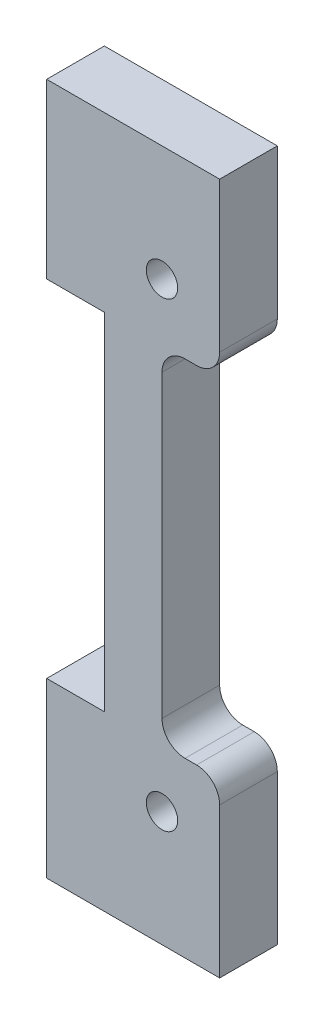
from build123d import *

# Parameters (mm, degrees)
BOSS_EXTRUDE1_START = -6.35
BOSS_EXTRUDE1_DEPTH = 6.35
FILLET1_R           = 2.54
SKETCH2_R           = 1.7272
CUT_EXTRUDE1_DEPTH  = 129.734406823


with BuildPart() as part:
    # Sketch1 → Boss-Extrude1 (new body)
    with BuildSketch(Plane.XY.offset(BOSS_EXTRUDE1_START)):
        Polygon((-107.95, -6.35), (-88.9, -6.35), (-88.9, 12.7), (-95.25, 12.7), (-95.25, 50.8), (-88.9, 50.8), (-88.9, 69.85), (-107.95, 69.85), (-107.95, 50.8), (-101.6, 50.8), (-101.6, 12.7), (-107.95, 12.7), align=None)
    extrude(amount=-BOSS_EXTRUDE1_DEPTH)

    # Fillet1
    fillet1_edges = [part.edges().sort_by_distance(p)[0] for p in [
        (-88.9, 50.8, -9.525),
        (-95.25, 50.8, -9.525),
        (-95.25, 12.7, -9.525),
        (-88.9, 12.7, -9.525),
    ]]
    fillet(fillet1_edges, radius=FILLET1_R)

    # Sketch2 → Cut-Extrude1 (cut, through all)
    with BuildSketch(Plane.XY.offset(-6.35)):
        with Locations((-95.25, 6.35)):
            Circle(SKETCH2_R)
        with Locations((-95.25, 57.15)):
            Circle(SKETCH2_R)
    extrude(amount=-CUT_EXTRUDE1_DEPTH, mode=Mode.SUBTRACT)


solid = part.part
